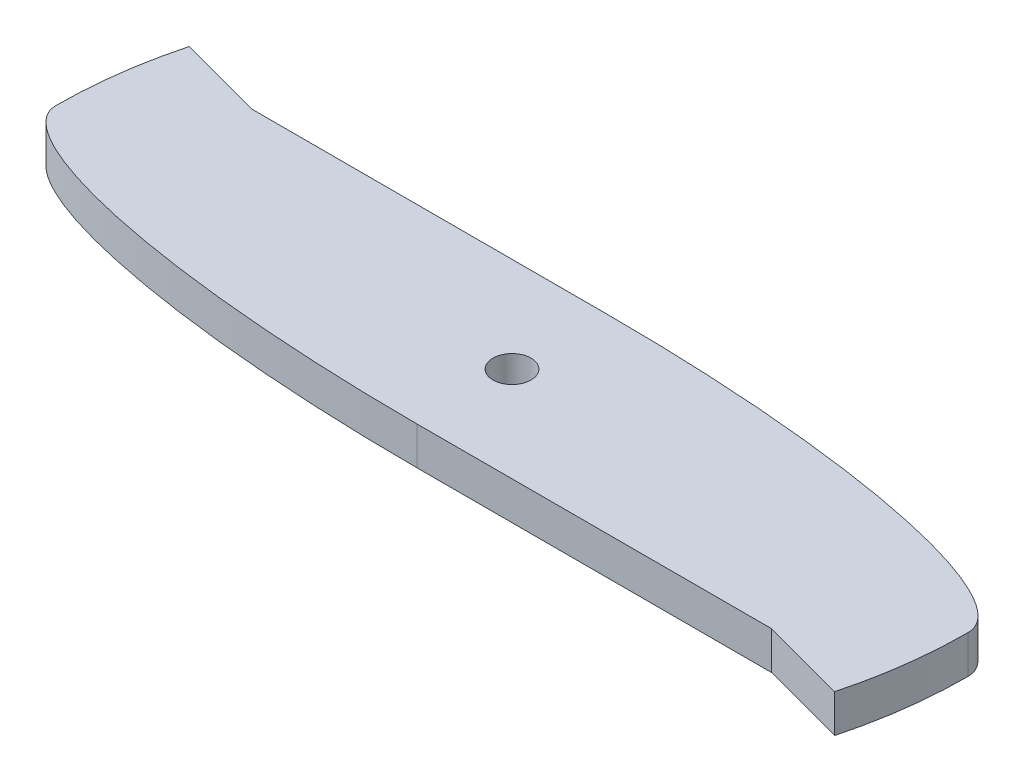
from build123d import *

# Parameters (mm, degrees)
SKETCH1_R           = 3.175
BOSS_EXTRUDE1_DEPTH = 3.175


with BuildPart() as part:
    # Sketch1 → Boss-Extrude1 (new, symmetric)
    with BuildSketch(Plane(origin=(0, 0, 0), x_dir=(1, 0, 0), z_dir=(0, 1, 0))):
        with BuildLine():
            Line((0, -15.875), (59.24630657, -15.875))
            Line((59.24630657, -15.875), (73.603547963, -19.722011237))
            ThreePointArc((73.603547963, -19.722011237), (75.548098437, -9.946095847), (76.2, 0))
            add(Edge.make_bspline(
                [(76.2, 0), (76.2, 15.875), (0, 15.875)],
                knots=[3.141592654, 3.141592654, 3.141592654, 4.71238898, 4.71238898, 4.71238898], degree=2, weights=[1, 0.707106781, 1]))
            Line((0, 15.875), (-59.24630657, 15.875))
            Line((-59.24630657, 15.875), (-73.603547963, 19.722011237))
            ThreePointArc((-73.603547963, 19.722011237), (-75.548098437, 9.946095847), (-76.2, 0))
            add(Edge.make_bspline(
                [(-76.2, 0), (-76.2, -15.875), (0, -15.875)],
                knots=[3.141592654, 3.141592654, 3.141592654, 4.71238898, 4.71238898, 4.71238898], degree=2, weights=[1, 0.707106781, 1]))
        make_face()
        with Locations(Location((0, 0, 0), (0, 0, 270))):
            Circle(SKETCH1_R, mode=Mode.SUBTRACT)
    extrude(amount=BOSS_EXTRUDE1_DEPTH, both=True)


solid = part.part
